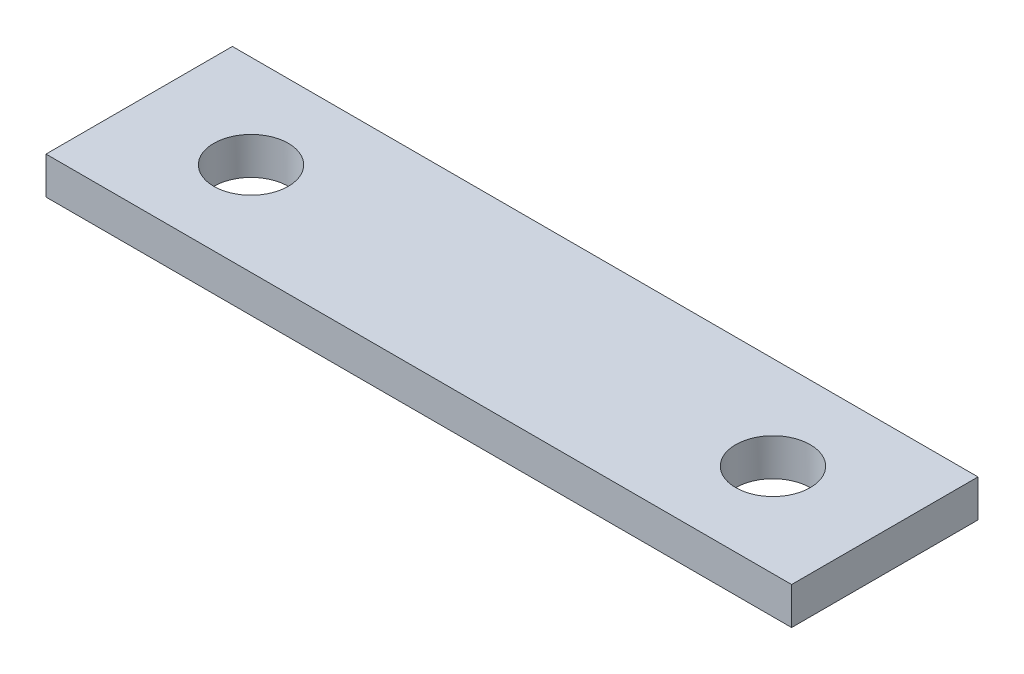
from build123d import *

# Parameters (mm, degrees)
SKETCH2_W               = 10
SKETCH2_H               = 2.5
BOSS_EXTRUDE1_DEPTH     = 0.5
CUT_EXTRUDE1_DEPTH      = 6.178078794
CUT_EXTRUDE1_DEPTH_BACK = 6.178078794
SKETCH3_R               = 0.5


with BuildPart() as part:
    # Sketch2 → Boss-Extrude1 (new body)
    with BuildSketch(Plane(origin=(0, 0, 0), x_dir=(1, 0, 0), z_dir=(0, 1, 0))):
        Rectangle(SKETCH2_W, SKETCH2_H)
    extrude(amount=BOSS_EXTRUDE1_DEPTH)

    # Sketch3 → Cut-Extrude1 (cut, two sides: drawn at the far end of the back side and taken through both)
    with BuildSketch(Plane(origin=(0, 0.5, 0), x_dir=(1, 0, 0), z_dir=(0, 1, 0)).offset(-CUT_EXTRUDE1_DEPTH_BACK)):
        with Locations(Location((-3.5, 0, 0), (0, 0, 270))):
            Circle(SKETCH3_R)
        with Locations(Location((3.5, 0, 0), (0, 0, 270))):
            Circle(SKETCH3_R)
    extrude(amount=CUT_EXTRUDE1_DEPTH + CUT_EXTRUDE1_DEPTH_BACK, mode=Mode.SUBTRACT)


solid = part.part
